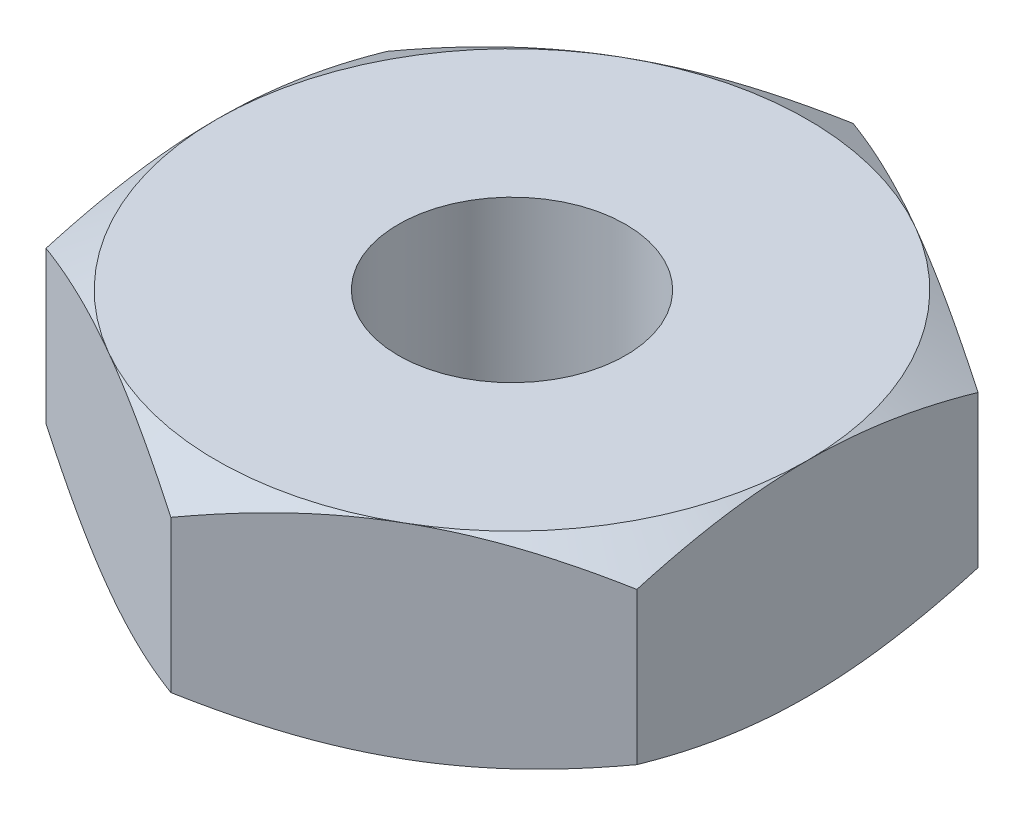
from build123d import *

# Parameters (mm, degrees)
SKETCH1_R               = 0.625
BOSS_EXTRUDE1_DEPTH     = 1.125
SKETCH2_OUTSIDE_W       = 13.196
SKETCH2_OUTSIDE_H       = 13.698
SKETCH2_OUTSIDE_R       = 1.625
CUT_EXTRUDE1_DEPTH      = 2
CUT_EXTRUDE1_DRAFT      = -60
MIRROR1_COPY_1_SKETCH_W = 13.196
MIRROR1_COPY_1_SKETCH_H = 13.698
MIRROR1_COPY_1_SKETCH_R = 1.625
MIRROR1_COPY_1_DEPTH    = 2
MIRROR1_COPY_1_DRAFT    = -60


with BuildPart() as part:
    # Sketch1 → Boss-Extrude1 (new body)
    with BuildSketch(Plane(origin=(0, 0, 0), x_dir=(1, 0, 0), z_dir=(0, 1, 0))):
        Polygon((0, 1.876388375), (-1.625, 0.938194187), (-1.625, -0.938194187), (0, -1.876388375), (1.625, -0.938194187), (1.625, 0.938194187), align=None)
        with Locations(Location((0, 0, 0), (0, 0, 270))):
            Circle(SKETCH1_R, mode=Mode.SUBTRACT)
    extrude(amount=BOSS_EXTRUDE1_DEPTH)


with BuildPart() as cut_extrude1_tool:
    # Sketch2 outside → Cut-Extrude1 (with draft: the straight prism first)
    with BuildSketch(Plane(origin=(0, 1.125, 0), x_dir=(1, 0, 0), z_dir=(0, 1, 0))):
        Rectangle(SKETCH2_OUTSIDE_W, SKETCH2_OUTSIDE_H)
        Circle(SKETCH2_OUTSIDE_R, mode=Mode.SUBTRACT)
    extrude(amount=-CUT_EXTRUDE1_DEPTH)
    # Cut-Extrude1: the draft: its side faces are tilted about the plane it starts from
    cut_extrude1_sides = [cut_extrude1_tool.faces().sort_by_distance(p)[0] for p in [
        (0, 0.125, 6.849),
        (6.598, 0.125, 0),
        (0, 0.125, -6.849),
        (-6.598, 0.125, 0),
        (-1.625, 0.125, 0),
    ]]
    draft(cut_extrude1_sides, Plane(origin=(0, 1.125, 0), x_dir=(1, 0, 0), z_dir=(0, 1, 0)), CUT_EXTRUDE1_DRAFT)


with BuildPart() as part_1:
    add(part.part)

    # Cut-Extrude1: cut by cut_extrude1_tool
    add(cut_extrude1_tool.part, mode=Mode.SUBTRACT)


with BuildPart() as mirror1_copy_1_tool:
    # Mirror1 copy 1 sketch → Mirror1 copy 1 (with draft: the straight prism first)
    with BuildSketch(Plane.XZ):
        Rectangle(MIRROR1_COPY_1_SKETCH_W, MIRROR1_COPY_1_SKETCH_H)
        Circle(MIRROR1_COPY_1_SKETCH_R, mode=Mode.SUBTRACT)
    extrude(amount=-MIRROR1_COPY_1_DEPTH)
    # Mirror1 copy 1: the draft: its side faces are tilted about the plane it starts from
    mirror1_copy_1_sides = [mirror1_copy_1_tool.faces().sort_by_distance(p)[0] for p in [
        (0, 1, 6.849),
        (6.598, 1, 0),
        (0, 1, -6.849),
        (-6.598, 1, 0),
        (-1.625, 1, 0),
    ]]
    draft(mirror1_copy_1_sides, Plane.XZ, MIRROR1_COPY_1_DRAFT)


with BuildPart() as part_2:
    add(part_1.part)

    # Mirror1 copy 1: cut by mirror1_copy_1_tool
    add(mirror1_copy_1_tool.part, mode=Mode.SUBTRACT)


solid = part_2.part
